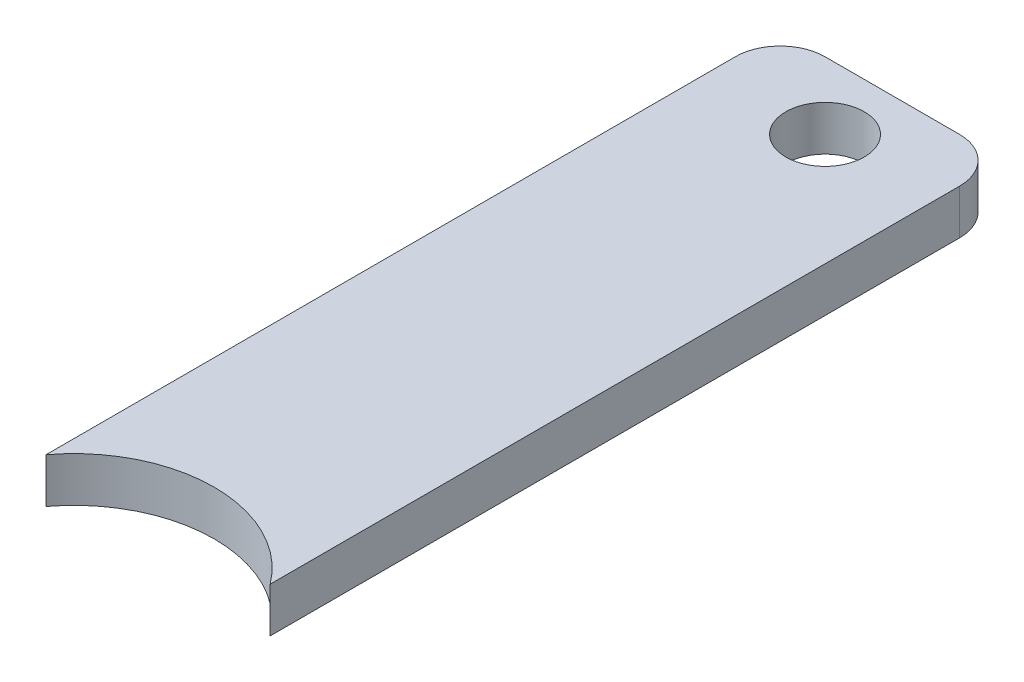
from build123d import *

# Parameters (mm, degrees)
SKETCH1_R           = 3.5
BOSS_EXTRUDE1_DEPTH = 4


with BuildPart() as part:
    # Sketch1 → Boss-Extrude1 (new body)
    with BuildSketch(Plane(origin=(0, 0, 0), x_dir=(1, 0, 0), z_dir=(0, 1, 0))):
        with BuildLine():
            Line((-10, 14.5), (-10, 76))
            ThreePointArc((-10, 76), (-8.828427125, 78.828427125), (-6, 80))
            Line((-6, 80), (6, 80))
            ThreePointArc((6, 80), (8.828427125, 78.828427125), (10, 76))
            Line((10, 76), (10, 14.5))
            ThreePointArc((10, 14.5), (0, 19.5), (-10, 14.5))
        make_face()
        with Locations(Location((0, 74, 0), (0, 0, 270))):
            Circle(SKETCH1_R, mode=Mode.SUBTRACT)
    extrude(amount=BOSS_EXTRUDE1_DEPTH)


solid = part.part
